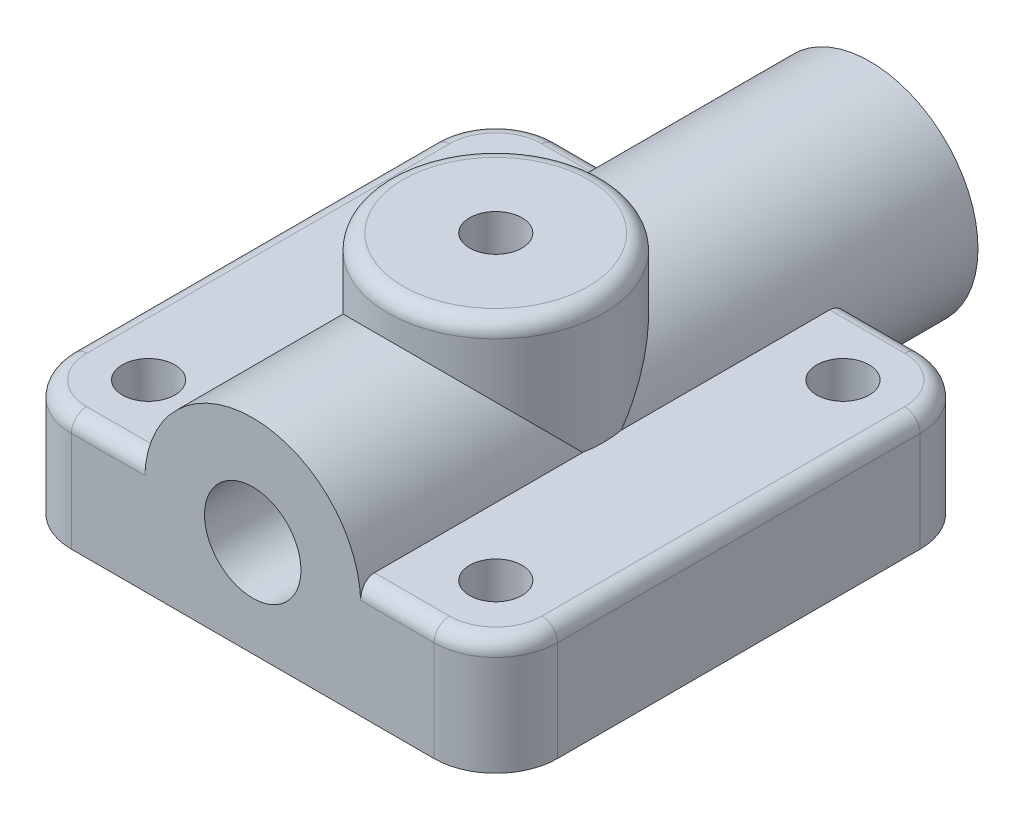
from build123d import *
from build123d.topology import SkipClean

# Parameters (mm, degrees)
EXTRUDE_1_DEPTH          = 15
SKETCH_2_R               = 14
EXTRUDE_2_DEPTH          = 16.5
FILLET_1_R               = 2
EXTRUDE_3_DEPTH          = 17
EXTRUDE_START            = 63
EXTRUDE_4_DEPTH          = 63
M14X1_5_1_D              = 12.5
HOLE_WIZARD_M8_1_REACH   = 67.854
HOLE_WIZARD_M8_1_BORE_R  = 3.4
CUT_EXTRUDE_1_REACH      = 67.854
CUT_EXTRUDE_1_END_RADIUS = 6.25
SKETCH_9_R               = 4.5
HOLE_WIZARD_M8_2_D       = 6.8
PATTERN_CIRCULAR_1_COUNT = 4


with BuildPart() as part:
    # 草图1 → 凸台-拉伸1 (new body)
    with BuildSketch(Plane(origin=(0, 0, 0), x_dir=(1, 0, 0), z_dir=(0, 1, 0))):
        with BuildLine():
            Line((-23.5, 31.5), (23.5, 31.5))
            ThreePointArc((23.5, 31.5), (29.156854249, 29.156854249), (31.5, 23.5))
            Line((31.5, 23.5), (31.5, -23.5))
            ThreePointArc((31.5, -23.5), (29.156854249, -29.156854249), (23.5, -31.5))
            Line((23.5, -31.5), (-23.5, -31.5))
            ThreePointArc((-23.5, -31.5), (-29.156854249, -29.156854249), (-31.5, -23.5))
            Line((-31.5, -23.5), (-31.5, 23.5))
            ThreePointArc((-31.5, 23.5), (-29.156854249, 29.156854249), (-23.5, 31.5))
        make_face()
    extrude(amount=EXTRUDE_1_DEPTH)

    # 草图2 → 凸台-拉伸2 (add)
    with BuildSketch(Plane(origin=(0, 15, 0), x_dir=(1, 0, 0), z_dir=(0, 1, 0))):
        with Locations(Location((0, 0, 0), (0, 0, 270))):
            Circle(SKETCH_2_R)
    extrude(amount=EXTRUDE_2_DEPTH)

    # 圆角1
    fillet_1_edges = [part.edges().sort_by_distance(p)[0] for p in [
        (29.156854249, 15, 29.156854249),
        (31.5, 15, 0),
        (29.156854249, 15, -29.156854249),
        (0, 15, -31.5),
        (0, 31.5, -14),
        (-29.156854249, 15, -29.156854249),
        (-31.5, 15, 0),
        (-29.156854249, 15, 29.156854249),
        (0, 15, 31.5),
    ]]
    fillet(fillet_1_edges, radius=FILLET_1_R)

    # 草图3 → 凸台-拉伸3 (add)
    with BuildSketch(Plane(origin=(0, 0, -31.5), x_dir=(-1, 0, 0), z_dir=(0, 0, -1))):
        with BuildLine():
            Line((-6.304760106, 0), (6.304760106, 0))
            ThreePointArc((6.304760106, 0), (0, 26.5), (-6.304760106, 0))
        make_face()
    extrude(amount=EXTRUDE_3_DEPTH)

    # 草图4 → 凸台-拉伸4 (add)
    with SkipClean():  # the faces are left unmerged after this step: merging them gives an invalid solid
        with BuildSketch(Plane.XY.offset(-31.5).offset(EXTRUDE_START)):
            with BuildLine():
                Line((-13.99106858, 13), (13.99106858, 13))
                ThreePointArc((13.99106858, 13), (0, 26.5), (-13.99106858, 13))
            make_face()
        extrude(amount=-EXTRUDE_4_DEPTH)

    # M14x1.5 螺纹孔1 (through all)
    with Locations(Plane(origin=(0, 0, -48.5), x_dir=(-1, 0, 0), z_dir=(0, 0, -1))):
        with Locations((0, 12.5)):
            Hole(M14X1_5_1_D / 2)

    # M8 螺纹孔1 bore → M8 螺纹孔1 (cut, up to next)
    with BuildSketch(Plane(origin=(0, 31.5, 0), x_dir=(1, 0, 0), z_dir=(0, 1, 0)), mode=Mode.PRIVATE) as hole_wizard_m8_1_sk1:
        Circle(HOLE_WIZARD_M8_1_BORE_R)
    hole_wizard_m8_1_tool1 = extrude(hole_wizard_m8_1_sk1.sketch, amount=-HOLE_WIZARD_M8_1_REACH, mode=Mode.PRIVATE) & part.part
    add(hole_wizard_m8_1_tool1.solids().sort_by_distance((0, 31.5, 0))[0], mode=Mode.SUBTRACT)

    # 切除-拉伸1: up to this cylinder (the profile starts outside it)
    with SkipClean():  # the faces are left unmerged after this step: merging them gives an invalid solid
        cut_extrude_1_end = Plane(origin=(0, 12.5, -15.5), z_dir=(0, 0, -1)) * Cylinder(CUT_EXTRUDE_1_END_RADIUS, 149.208, mode=Mode.PRIVATE)
        # 草图9 → 切除-拉伸1 (cut, up to the surface)
        with BuildSketch(Plane.XZ, mode=Mode.PRIVATE) as cut_extrude_1_sk1:
            with Locations(Location((0, -15.5, 0), (0, 0, 270))):
                Circle(SKETCH_9_R)
        cut_extrude_1_tool1 = extrude(cut_extrude_1_sk1.sketch, amount=-CUT_EXTRUDE_1_REACH, mode=Mode.PRIVATE) - cut_extrude_1_end
        add(cut_extrude_1_tool1.solids().sort_by_distance((0, 0, -15.5))[0], mode=Mode.SUBTRACT)

    # M8 螺纹孔2 (through all)
    with Locations(Plane(origin=(0, 15, 0), x_dir=(1, 0, 0), z_dir=(0, 1, 0))):
        with Locations((-22.5, 22.5)):
            hole_wizard_m8_2 = Hole(HOLE_WIZARD_M8_2_D / 2)

    # 阵列(圆周)1: M8 螺纹孔2 ×4 about axis
    with SkipClean():  # the faces are left unmerged after this step: merging them gives an invalid solid
        pattern_circular_1_axis = Axis((0, 0, 0), (0, 1, 0))
        for i in range(1, PATTERN_CIRCULAR_1_COUNT):
            add(hole_wizard_m8_2.rotate(pattern_circular_1_axis, i * 360 / PATTERN_CIRCULAR_1_COUNT), mode=Mode.SUBTRACT)


solid = part.part
